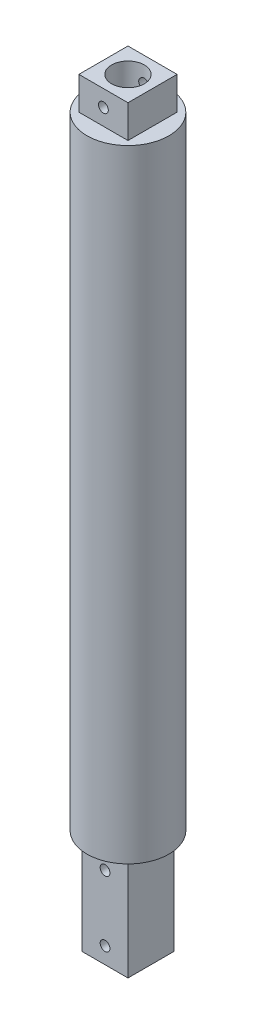
from build123d import *

# Parameters (mm, degrees)
SKETCH1_W           = 14
SKETCH1_H           = 32
SKETCH1_R           = 1.5
BOSS_EXTRUDE1_DEPTH = 7
SKETCH3_R           = 12.5
BOSS_EXTRUDE2_DEPTH = 200
SKETCH4_OUTSIDE_W   = 73.936
SKETCH4_OUTSIDE_H   = 73.936
SKETCH4_OUTSIDE_W_2 = 15
SKETCH4_OUTSIDE_H_2 = 15
CUT_EXTRUDE1_DEPTH  = 10
SKETCH5_R           = 1.5
CUT_EXTRUDE2_DEPTH  = 234.195733237
SKETCH6_R           = 5
CUT_EXTRUDE3_DEPTH  = 233.672516641


with BuildPart() as part:
    # Sketch1 → Boss-Extrude1 (new, symmetric)
    with BuildSketch(Plane.XY):
        with Locations((0, 16)):
            Rectangle(SKETCH1_W, SKETCH1_H)
        with Locations((0, 5)):
            Circle(SKETCH1_R, mode=Mode.SUBTRACT)
        with Locations((0, 25)):
            Circle(SKETCH1_R, mode=Mode.SUBTRACT)
    extrude(amount=BOSS_EXTRUDE1_DEPTH, both=True)

    # Sketch3 → Boss-Extrude2 (add)
    with BuildSketch(Plane(origin=(0, 32, 0), x_dir=(1, 0, 0), z_dir=(0, 1, 0))):
        with Locations(Location((0, 0, 0), (0, 0, 270))):
            Circle(SKETCH3_R)
    extrude(amount=BOSS_EXTRUDE2_DEPTH)

    # Sketch4 outside → Cut-Extrude1 (cut)
    with BuildSketch(Plane(origin=(0, 232, 0), x_dir=(1, 0, 0), z_dir=(0, 1, 0))):
        Rectangle(SKETCH4_OUTSIDE_W, SKETCH4_OUTSIDE_H)
        Rectangle(SKETCH4_OUTSIDE_W_2, SKETCH4_OUTSIDE_H_2, mode=Mode.SUBTRACT)
    extrude(amount=-CUT_EXTRUDE1_DEPTH, mode=Mode.SUBTRACT)

    # Sketch5 → Cut-Extrude2 (cut, through all)
    with BuildSketch(Plane.XY.offset(7.5)):
        with Locations((0, 227)):
            Circle(SKETCH5_R)
    extrude(amount=-CUT_EXTRUDE2_DEPTH, mode=Mode.SUBTRACT)

    # Sketch6 → Cut-Extrude3 (cut, through all)
    with BuildSketch(Plane.XZ):
        Circle(SKETCH6_R)
    extrude(amount=-CUT_EXTRUDE3_DEPTH, mode=Mode.SUBTRACT)


solid = part.part
